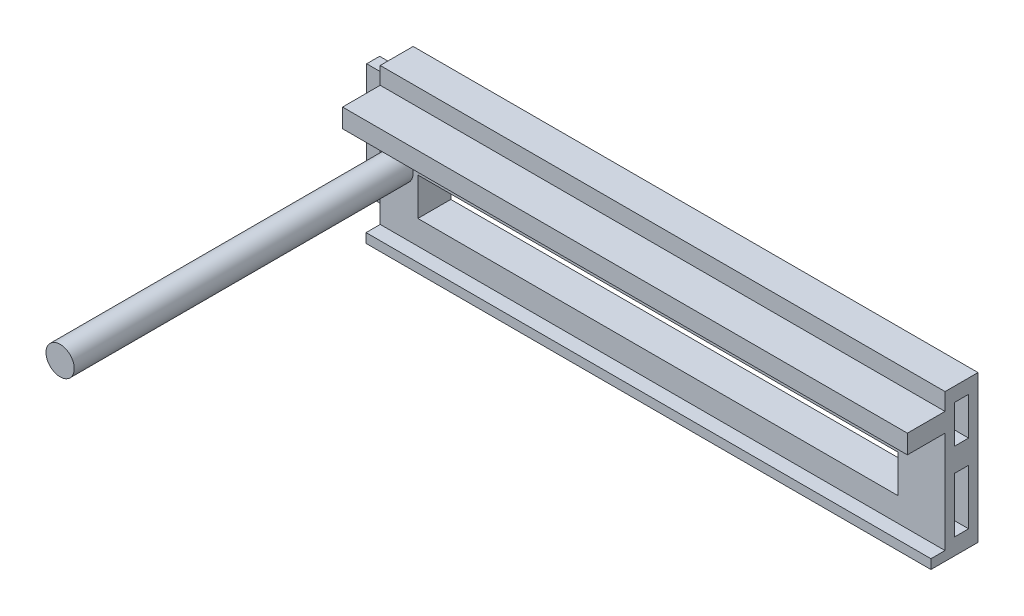
from build123d import *

# Parameters (mm, degrees)
SKETCH1_W               = 120
SKETCH1_H               = 31.25
BOSS_EXTRUDE1_DEPTH     = 7
SKETCH2_W               = 120
SKETCH2_H               = 4
SKETCH2_H_2             = 2
BOSS_EXTRUDE2_DEPTH     = 8
CUT_EXTRUDE1_DEPTH      = 125.260059955
CUT_EXTRUDE1_DEPTH_BACK = 125.260059955
SKETCH3_W               = 102
SKETCH3_H               = 8
SKETCH3_H_2             = 3.5
SKETCH4_W               = 2.75
SKETCH4_H               = 7.59061182
SKETCH4_H_2             = 11.2
BOSS_EXTRUDE3_DEPTH     = 5
SKETCH5_W               = 3
SKETCH5_H               = 8.0580149
SKETCH5_H_2             = 11.6919851
CUT_EXTRUDE2_DEPTH      = 5
CUT_EXTRUDE3_REACH      = 126.906
SKETCH6_W               = 5
SKETCH6_H               = 2
SKETCH7_R               = 3
BOSS_EXTRUDE4_DEPTH     = 72


with BuildPart() as part:
    # Sketch1 → Boss-Extrude1 (new body)
    with BuildSketch(Plane.XY):
        with Locations((60, 15.625)):
            Rectangle(SKETCH1_W, SKETCH1_H)
    extrude(amount=BOSS_EXTRUDE1_DEPTH)

    # Sketch2 → Boss-Extrude2 (add)
    with BuildSketch(Plane.XY.offset(7)):
        with Locations((60, 25.6)):
            Rectangle(SKETCH2_W, SKETCH2_H)
        with Locations((60, 1)):
            Rectangle(SKETCH2_W, SKETCH2_H_2)
    extrude(amount=BOSS_EXTRUDE2_DEPTH)

    # Sketch3 → Cut-Extrude1 (cut, two sides: drawn at the far end of the back side and taken through both)
    with BuildSketch(Plane.XY.offset(7).offset(-CUT_EXTRUDE1_DEPTH_BACK)):
        with Locations((59, 11.1)):
            Rectangle(SKETCH3_W, SKETCH3_H)
        with Locations((59, 21.85)):
            Rectangle(SKETCH3_W, SKETCH3_H_2)
    extrude(amount=CUT_EXTRUDE1_DEPTH + CUT_EXTRUDE1_DEPTH_BACK, mode=Mode.SUBTRACT)

    # Sketch4 → Boss-Extrude3 (add)
    with BuildSketch(Plane.ZY):
        with Locations((3.5, 24.20469409)):
            Rectangle(SKETCH4_W, SKETCH4_H)
        with Locations((3.5, 9.35)):
            Rectangle(SKETCH4_W, SKETCH4_H_2)
    extrude(amount=BOSS_EXTRUDE3_DEPTH)

    # Sketch5 → Cut-Extrude2 (cut)
    with BuildSketch(Plane(origin=(120, 0, 0), x_dir=(0, 0, -1), z_dir=(1, 0, 0))):
        with Locations((-3.5, 24.22099255)):
            Rectangle(SKETCH5_W, SKETCH5_H)
        with Locations((-3.5, 9.34599255)):
            Rectangle(SKETCH5_W, SKETCH5_H_2)
    extrude(amount=-CUT_EXTRUDE2_DEPTH, mode=Mode.SUBTRACT)

    # Sketch6 → Cut-Extrude3 (cut, up to next)
    with BuildSketch(Plane.ZY, mode=Mode.PRIVATE) as cut_extrude3_sk1:
        with Locations((12.5, 1)):
            Rectangle(SKETCH6_W, SKETCH6_H)
    cut_extrude3_tool1 = extrude(cut_extrude3_sk1.sketch, amount=-CUT_EXTRUDE3_REACH, mode=Mode.PRIVATE) & part.part
    add(cut_extrude3_tool1.solids().sort_by_distance((0, 1, 12.5))[0], mode=Mode.SUBTRACT)

    # Sketch7 → Boss-Extrude4 (add)
    with BuildSketch(Plane.XY.offset(7)):
        with Locations((4, 14.95)):
            Circle(SKETCH7_R)
    extrude(amount=BOSS_EXTRUDE4_DEPTH)


solid = part.part
